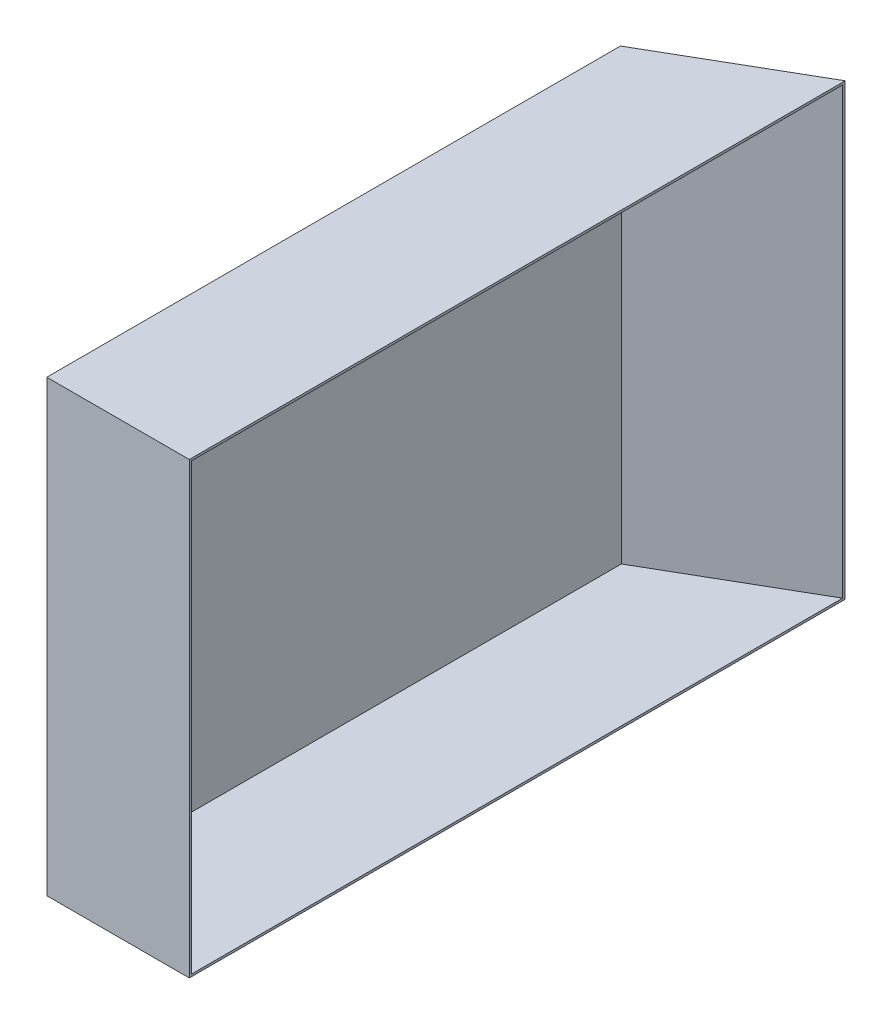
from build123d import *

# Parameters (mm, degrees)
BOSS_EXTRUDE1_DEPTH = 500
SHELL1_T            = -2.54


with BuildPart() as part:
    # Sketch1 → Boss-Extrude1 (new body)
    with BuildSketch(Plane(origin=(0, 254, 0), x_dir=(1, 0, 0), z_dir=(0, 1, 0))):
        Polygon((196.776289053, 227.031674573), (38.1, 135.419876374), (38.1, -503.309343177), (196.776289053, -503.309343177), align=None)
    extrude(amount=-BOSS_EXTRUDE1_DEPTH)

    # Shell1
    shell1_openings = [part.faces().sort_by_distance(p)[0] for p in [
        (196.776289053, 4, 138.138834302),
    ]]
    offset(amount=SHELL1_T, openings=shell1_openings, kind=Kind.INTERSECTION)


solid = part.part
